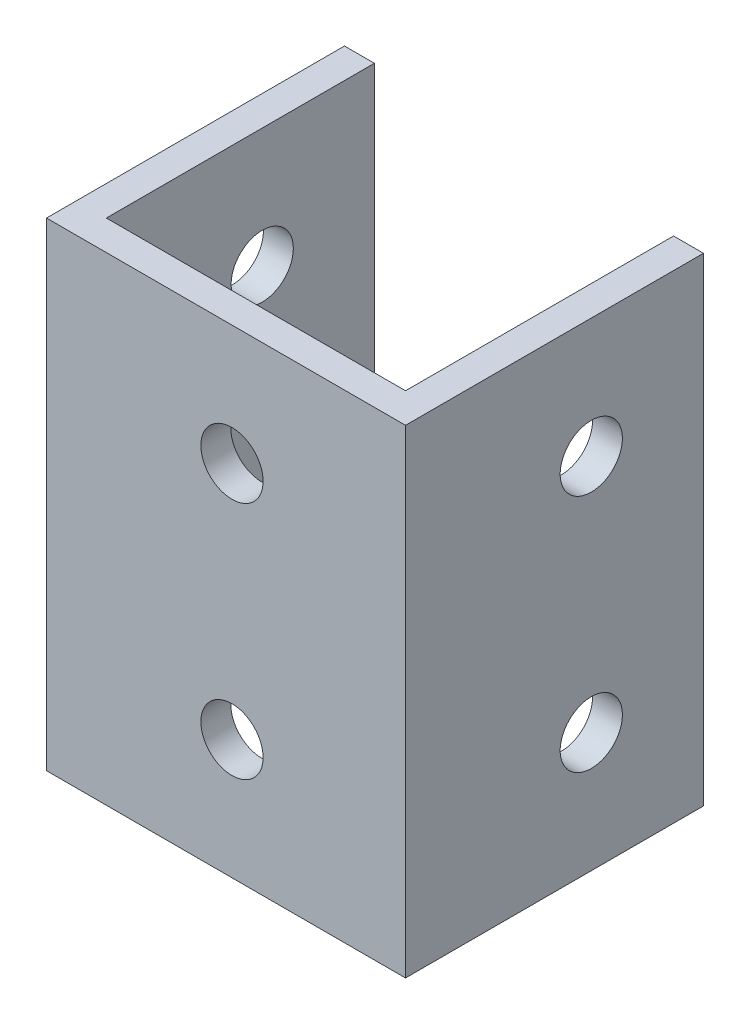
from build123d import *

# Parameters (mm, degrees)
BOSS_EXTRUDE1_DEPTH = 50.8
SKETCH3_R           = 3.302
CUT_EXTRUDE1_DEPTH  = 50.8
SKETCH4_R           = 3.302
CUT_EXTRUDE2_DEPTH  = 71.938453105


with BuildPart() as part:
    # Sketch2 → Boss-Extrude1 (new body)
    with BuildSketch(Plane(origin=(0, 0, 0), x_dir=(1, 0, 0), z_dir=(0, 1, 0))):
        Polygon((0, 0), (0, -31.623), (38.1, -31.623), (38.1, 0), (34.925, 0), (34.925, -28.448), (3.175, -28.448), (3.175, 0), align=None)
    extrude(amount=BOSS_EXTRUDE1_DEPTH)

    # Sketch3 → Cut-Extrude1 (cut)
    with BuildSketch(Plane(origin=(0, 0, 28.448), x_dir=(-1, 0, 0), z_dir=(0, 0, -1))):
        with Locations((-19.685, 12.7)):
            Circle(SKETCH3_R)
        with Locations((-19.685, 38.091107032)):
            Circle(SKETCH3_R)
    extrude(amount=-CUT_EXTRUDE1_DEPTH, mode=Mode.SUBTRACT)

    # Sketch4 → Cut-Extrude2 (cut, through all)
    with BuildSketch(Plane(origin=(38.1, 0, 0), x_dir=(0, 0, -1), z_dir=(1, 0, 0))):
        with Locations((-11.90625, 38.1)):
            Circle(SKETCH4_R)
        with Locations((-11.90625, 12.7)):
            Circle(SKETCH4_R)
    extrude(amount=-CUT_EXTRUDE2_DEPTH, mode=Mode.SUBTRACT)


solid = part.part
